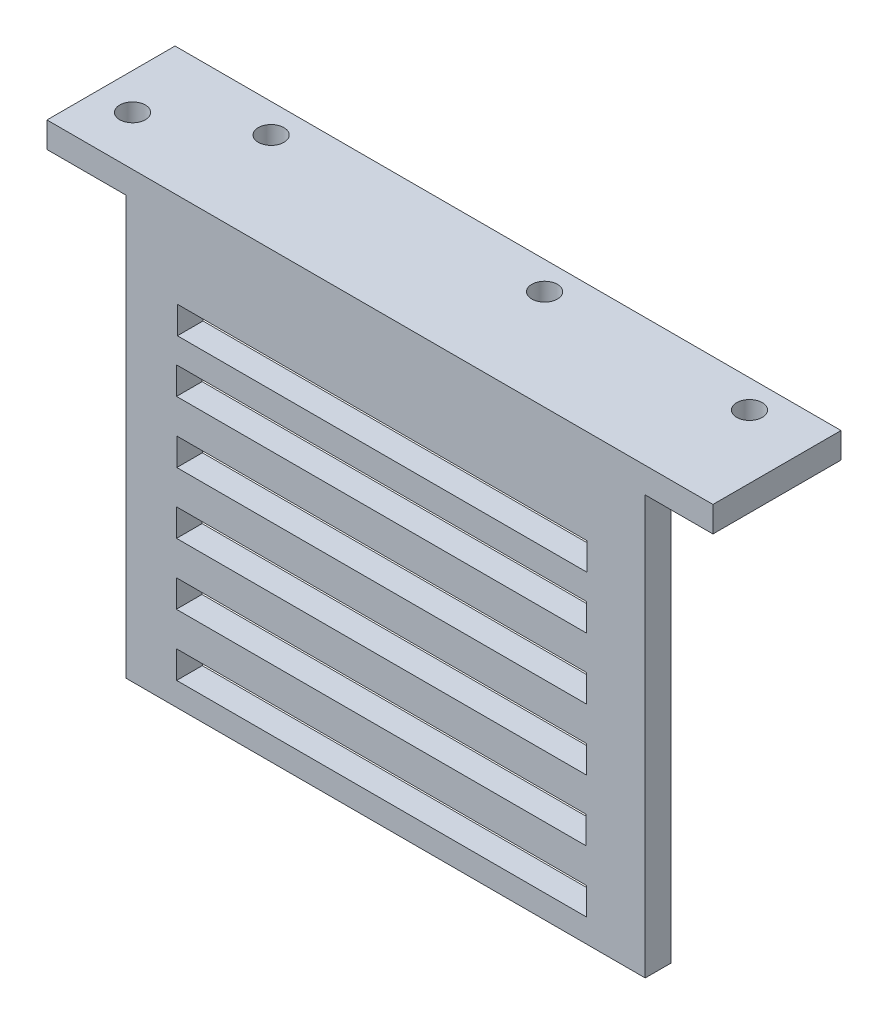
from build123d import *

# Parameters (mm, degrees)
SKETCH_1_W                = 78
SKETCH_1_H                = 15
EXTRUDE_1_DEPTH           = 3
SKETCH_3_R                = 1.5
CUT_EXTRUDE_1_DEPTH       = 3
SKETCH_4_R                = 6
EXTRUDE_2_DEPTH           = 18
SKETCH_5_R                = 4.5
CUT_EXTRUDE_2_DEPTH       = 21
F_2_0MM_2_D               = 3
F_2_0MM_2_DEPTH           = 4.5
F_2_0MM_2_TIP             = 1.5
F_2_0MM_2_ON_FACE_2_D     = 3
F_2_0MM_2_ON_FACE_2_DEPTH = 4.5
F_2_0MM_2_ON_FACE_2_TIP   = 1.5
SKETCH_10_W               = 6
SKETCH_10_H               = 10
CUT_EXTRUDE_3_DEPTH       = 7
SKETCH_13_W               = 19.835687411
SKETCH_13_H               = 21.610205193
CUT_EXTRUDE_4_DEPTH       = 20
SKETCH_14_W               = 11.523038103
SKETCH_14_H               = 10.49031299
EXTRUDE_3_DEPTH           = 3
SKETCH_18_W               = 78
SKETCH_18_H               = 8
EXTRUDE_4_DEPTH           = 3
SKETCH_19_W               = 36.767904102
SKETCH_19_H               = 2.5
EXTRUDE_5_DEPTH           = 12.5
SKETCH_23_R               = 1.65
CUT_EXTRUDE_6_DEPTH       = 12.5
SKETCH_25_W               = 4.236607592
SKETCH_25_H               = 5.36409187
EXTRUDE_7_DEPTH           = 2.5
SKETCH_26_R               = 1.6
CUT_EXTRUDE_7_DEPTH       = 2.5
SKETCH_27_W               = 21.346012392
SKETCH_27_H               = 6.594354882
EXTRUDE_8_DEPTH           = 2.5
SKETCH_28_W               = 36.767231154
SKETCH_28_H               = 5.91819544
EXTRUDE_9_DEPTH           = 2.5
SKETCH_29_W               = 27.660340415
SKETCH_29_H               = 3.5
CUT_EXTRUDE_9_DEPTH       = 2.5
SKETCH_30_W               = 78
SKETCH_30_H               = 8
CUT_EXTRUDE_10_DEPTH      = 100
SKETCH_31_W               = 60.820132647
SKETCH_31_H               = 3
EXTRUDE_10_DEPTH          = 49
SKETCH_32_W               = 48
SKETCH_32_H               = 3.2
CUT_EXTRUDE_11_DEPTH      = 49


with BuildPart() as part:
    # 草图1 → 凸台-拉伸1 (new body)
    with BuildSketch(Plane(origin=(0, 0, 0), x_dir=(1, 0, 0), z_dir=(0, 1, 0))):
        Rectangle(SKETCH_1_W, SKETCH_1_H)
    extrude(amount=EXTRUDE_1_DEPTH)

    # 草图3 → 切除-拉伸1 (cut)
    with BuildSketch(Plane(origin=(0, 3, 0), x_dir=(1, 0, 0), z_dir=(0, 1, 0))):
        with Locations(Location((-34.76, -1.72, 0), (0, 0, 270))):
            Circle(SKETCH_3_R)
        with Locations(Location((-24.35, 4.1, 0), (0, 0, 270))):
            Circle(SKETCH_3_R)
        with Locations(Location((31.56, 4.221692081, 0), (0, 0, 270))):
            Circle(SKETCH_3_R)
        with Locations(Location((7.56, 4.221692081, 0), (0, 0, 270))):
            Circle(SKETCH_3_R)
    extrude(amount=-CUT_EXTRUDE_1_DEPTH, mode=Mode.SUBTRACT)

    # 草图4 → 凸台-拉伸2 (add)
    with BuildSketch(Plane(origin=(0, 3, 0), x_dir=(1, 0, 0), z_dir=(0, 1, 0))):
        with Locations(Location((-3, -1.234165229, 0), (0, 0, 270))):
            Circle(SKETCH_4_R)
    extrude(amount=EXTRUDE_2_DEPTH)

    # 草图5 → 切除-拉伸2 (cut)
    with BuildSketch(Plane(origin=(0, 21, 0), x_dir=(1, 0, 0), z_dir=(0, 1, 0))):
        with Locations(Location((-3, -1.234165229, 0), (0, 0, 270))):
            Circle(SKETCH_5_R)
    extrude(amount=-CUT_EXTRUDE_2_DEPTH, mode=Mode.SUBTRACT)

    # Ø2.0mm 暗销孔2
    with Locations(Plane(origin=(-7.901331048, 17.342107422, 4.694938836), x_dir=(-0.576795601176, 0, -0.816888507977), z_dir=(-0.816888507977, 0, 0.576795601176))):
        with Locations((0, 0)):
            Hole(F_2_0MM_2_D / 2, depth=F_2_0MM_2_DEPTH)
            with Locations((0, 0, -(F_2_0MM_2_DEPTH + F_2_0MM_2_TIP / 2))):  # 90° drill point
                Cone(0, F_2_0MM_2_D / 2, F_2_0MM_2_TIP, mode=Mode.SUBTRACT)

    # Ø2.0mm 暗销孔2 on face 2
    with Locations(Plane(origin=(1.071764877, 17.164817099, 5.641061052), x_dir=(0.734483043181, 0, -0.678627039897), z_dir=(0.678627039897, 0, 0.734483043181))):
        with Locations((0, 0)):
            Hole(F_2_0MM_2_ON_FACE_2_D / 2, depth=F_2_0MM_2_ON_FACE_2_DEPTH)
            with Locations((0, 0, -(F_2_0MM_2_ON_FACE_2_DEPTH + F_2_0MM_2_ON_FACE_2_TIP / 2))):  # 90° drill point
                Cone(0, F_2_0MM_2_ON_FACE_2_D / 2, F_2_0MM_2_ON_FACE_2_TIP, mode=Mode.SUBTRACT)

    # 草图10 → 切除-拉伸3 (cut)
    with BuildSketch(Plane(origin=(0, 0, -7.5), x_dir=(-1, 0, 0), z_dir=(0, 0, -1))):
        with Locations((3, 8)):
            Rectangle(SKETCH_10_W, SKETCH_10_H)
    extrude(amount=-CUT_EXTRUDE_3_DEPTH, mode=Mode.SUBTRACT)

    # 草图13 → 切除-拉伸4 (cut)
    with BuildSketch(Plane(origin=(0, 0, -7.5), x_dir=(-1, 0, 0), z_dir=(0, 0, -1))):
        with Locations((3.314421038, 13.805102597)):
            Rectangle(SKETCH_13_W, SKETCH_13_H)
    extrude(amount=-CUT_EXTRUDE_4_DEPTH, mode=Mode.SUBTRACT)

    # 草图14 → 凸台-拉伸3 (add)
    with BuildSketch(Plane(origin=(0, 3, 0), x_dir=(1, 0, 0), z_dir=(0, 1, 0))):
        with Locations((-2.989467433, -1.263493391)):
            Rectangle(SKETCH_14_W, SKETCH_14_H)
    extrude(amount=-EXTRUDE_3_DEPTH)

    # 草图18 → 凸台-拉伸4 (add)
    with BuildSketch(Plane.XZ):
        with Locations((0, 11.5)):
            Rectangle(SKETCH_18_W, SKETCH_18_H)
    extrude(amount=-EXTRUDE_4_DEPTH)

    # 草图19 → 凸台-拉伸5 (add)
    with BuildSketch(Plane.XZ):
        with Locations((0.839237194, 14.25)):
            Rectangle(SKETCH_19_W, SKETCH_19_H)
    extrude(amount=EXTRUDE_5_DEPTH)

    # 草图23 → 切除-拉伸6 (cut)
    with BuildSketch(Plane(origin=(0, 0, 13), x_dir=(-1, 0, 0), z_dir=(0, 0, -1))):
        with Locations((-8.603189245, -6.05592298)):
            Circle(SKETCH_23_R)
        with Locations((2.596810755, -6.05592298)):
            Circle(SKETCH_23_R)
    extrude(amount=-CUT_EXTRUDE_6_DEPTH, mode=Mode.SUBTRACT)

    # 草图25 → 凸台-拉伸7 (add)
    with BuildSketch(Plane(origin=(0, 0, 13), x_dir=(-1, 0, 0), z_dir=(0, 0, -1))):
        with Locations((2.330668631, -6.426480946)):
            Rectangle(SKETCH_25_W, SKETCH_25_H)
    extrude(amount=-EXTRUDE_7_DEPTH)

    # 草图26 → 切除-拉伸7 (cut)
    with BuildSketch(Plane(origin=(0, 0, 13), x_dir=(-1, 0, 0), z_dir=(0, 0, -1))):
        with Locations((4.196810755, -6.05592298)):
            Circle(SKETCH_26_R)
    extrude(amount=-CUT_EXTRUDE_7_DEPTH, mode=Mode.SUBTRACT)

    # 草图27 → 凸台-拉伸8 (add)
    with BuildSketch(Plane(origin=(0, 0, 13), x_dir=(-1, 0, 0), z_dir=(0, 0, -1))):
        with Locations((-2.379316694, -6.691741876)):
            Rectangle(SKETCH_27_W, SKETCH_27_H)
    extrude(amount=-EXTRUDE_8_DEPTH)

    # 草图28 → 凸台-拉伸9 (add)
    with BuildSketch(Plane(origin=(0, 0, 13), x_dir=(-1, 0, 0), z_dir=(0, 0, -1))):
        with Locations((-0.839573668, -15.45909772)):
            Rectangle(SKETCH_28_W, SKETCH_28_H)
    extrude(amount=-EXTRUDE_9_DEPTH)

    # 草图29 → 切除-拉伸9 (cut)
    with BuildSketch(Plane(origin=(0, 0, 13), x_dir=(-1, 0, 0), z_dir=(0, 0, -1))):
        with Locations((-0.633763758, -13.394190827)):
            Rectangle(SKETCH_29_W, SKETCH_29_H)
    extrude(amount=-CUT_EXTRUDE_9_DEPTH, mode=Mode.SUBTRACT)

    # 草图30 → 切除-拉伸10 (cut)
    with BuildSketch(Plane(origin=(0, 3, 0), x_dir=(1, 0, 0), z_dir=(0, 1, 0))):
        with Locations((0, -11.5)):
            Rectangle(SKETCH_30_W, SKETCH_30_H)
    extrude(amount=-CUT_EXTRUDE_10_DEPTH, mode=Mode.SUBTRACT)

    # 草图31 → 凸台-拉伸10 (add)
    with BuildSketch(Plane.XZ):
        with Locations((0.65611444, 6)):
            Rectangle(SKETCH_31_W, SKETCH_31_H)
    extrude(amount=EXTRUDE_10_DEPTH)

    # 草图32 → 切除-拉伸11 (cut)
    with BuildSketch(Plane(origin=(0, 0, 4.5), x_dir=(-1, 0, 0), z_dir=(0, 0, -1))):
        with Locations((-0.175604554, -15.854114518)):
            Rectangle(SKETCH_32_W, SKETCH_32_H)
        with Locations((-0.205191163, -23.054114518)):
            Rectangle(SKETCH_32_W, SKETCH_32_H)
        with Locations((-0.173277927, -30.254114518)):
            Rectangle(SKETCH_32_W, SKETCH_32_H)
        with Locations((-0.15338956, -37.454114518)):
            Rectangle(SKETCH_32_W, SKETCH_32_H)
        with Locations((-0.189333293, -44.654114518)):
            Rectangle(SKETCH_32_W, SKETCH_32_H)
        with Locations((-0.276259634, -9.654114518)):
            Rectangle(SKETCH_32_W, SKETCH_32_H)
    extrude(amount=-CUT_EXTRUDE_11_DEPTH, mode=Mode.SUBTRACT)


solid = part.part
